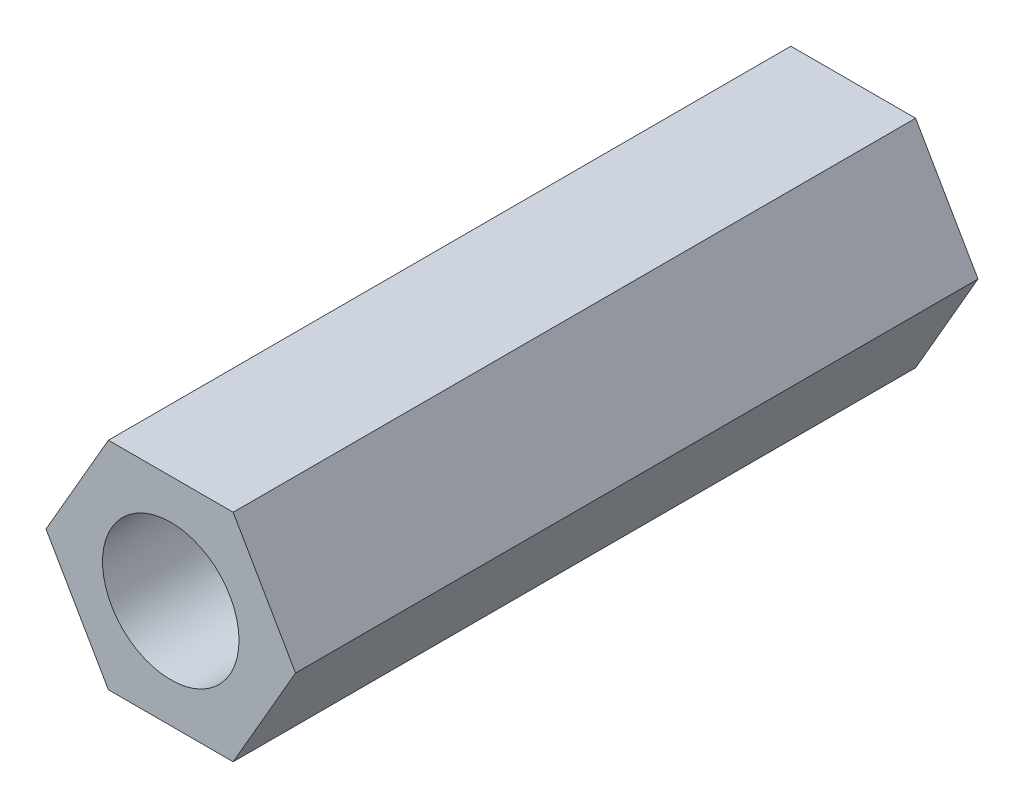
from build123d import *

# Parameters (mm, degrees)
SKETCH_1_R      = 1.5
EXTRUDE_1_DEPTH = 15


with BuildPart() as part:
    # 草图1 → 凸台-拉伸1 (new body)
    with BuildSketch(Plane.XY):
        Polygon((2.742413779, 0), (1.371206889, 2.375), (-1.371206889, 2.375), (-2.742413779, 0), (-1.371206889, -2.375), (1.371206889, -2.375), align=None)
        Circle(SKETCH_1_R, mode=Mode.SUBTRACT)
    extrude(amount=EXTRUDE_1_DEPTH)


solid = part.part
